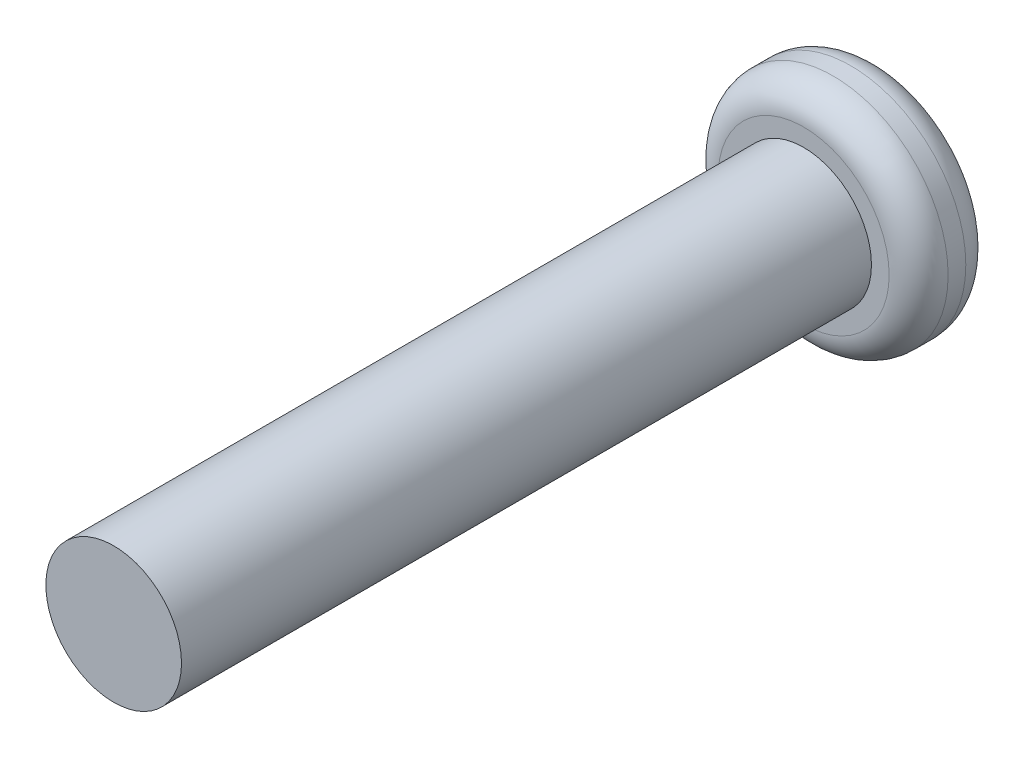
from build123d import *

# Parameters (mm, degrees)
SKETCH1_R           = 1.95
BOSS_EXTRUDE1_DEPTH = 1.3
CUT_EXTRUDE1_DEPTH  = 1
SKETCH3_R           = 1.15
BOSS_EXTRUDE2_DEPTH = 11.7
FILLET1_R           = 0.5


with BuildPart() as part:
    # Sketch1 → Boss-Extrude1 (new body)
    with BuildSketch(Plane.XY):
        Circle(SKETCH1_R)
    extrude(amount=BOSS_EXTRUDE1_DEPTH)

    # Sketch2 → Cut-Extrude1 (cut)
    with BuildSketch(Plane(origin=(0, 0, 0), x_dir=(-1, 0, 0), z_dir=(0, 0, -1))):
        with BuildLine():
            Line((-0.15, 1.25), (0.15, 1.25))
            ThreePointArc((0.15, 1.25), (0.291421356, 1.191421356), (0.35, 1.05))
            Line((0.35, 1.05), (0.35, 0.55))
            ThreePointArc((0.35, 0.55), (0.408578644, 0.408578644), (0.55, 0.35))
            Line((0.55, 0.35), (1.05, 0.35))
            ThreePointArc((1.05, 0.35), (1.191421356, 0.291421356), (1.25, 0.15))
            Line((1.25, 0.15), (1.25, -0.15))
            ThreePointArc((1.25, -0.15), (1.191421356, -0.291421356), (1.05, -0.35))
            Line((1.05, -0.35), (0.55, -0.35))
            ThreePointArc((0.55, -0.35), (0.408578644, -0.408578644), (0.35, -0.55))
            Line((0.35, -0.55), (0.35, -1.05))
            ThreePointArc((0.35, -1.05), (0.291421356, -1.191421356), (0.15, -1.25))
            Line((0.15, -1.25), (-0.15, -1.25))
            ThreePointArc((-0.15, -1.25), (-0.291421356, -1.191421356), (-0.35, -1.05))
            Line((-0.35, -1.05), (-0.35, -0.55))
            ThreePointArc((-0.35, -0.55), (-0.408578644, -0.408578644), (-0.55, -0.35))
            Line((-0.55, -0.35), (-1.05, -0.35))
            ThreePointArc((-1.05, -0.35), (-1.191421356, -0.291421356), (-1.25, -0.15))
            Line((-1.25, -0.15), (-1.25, 0.15))
            ThreePointArc((-1.25, 0.15), (-1.191421356, 0.291421356), (-1.05, 0.35))
            Line((-1.05, 0.35), (-0.55, 0.35))
            ThreePointArc((-0.55, 0.35), (-0.408578644, 0.408578644), (-0.35, 0.55))
            Line((-0.35, 0.55), (-0.35, 1.05))
            ThreePointArc((-0.35, 1.05), (-0.291421356, 1.191421356), (-0.15, 1.25))
        make_face()
    extrude(amount=-CUT_EXTRUDE1_DEPTH, mode=Mode.SUBTRACT)

    # Sketch3 → Boss-Extrude2 (add)
    with BuildSketch(Plane.XY.offset(1.3)):
        Circle(SKETCH3_R)
    extrude(amount=BOSS_EXTRUDE2_DEPTH)

    # Fillet1
    fillet1_edges = [part.edges().sort_by_distance(p)[0] for p in [
        (-1.95, 0, 0),
        (-1.95, 0, 1.3),
    ]]
    fillet(fillet1_edges, radius=FILLET1_R)


solid = part.part
